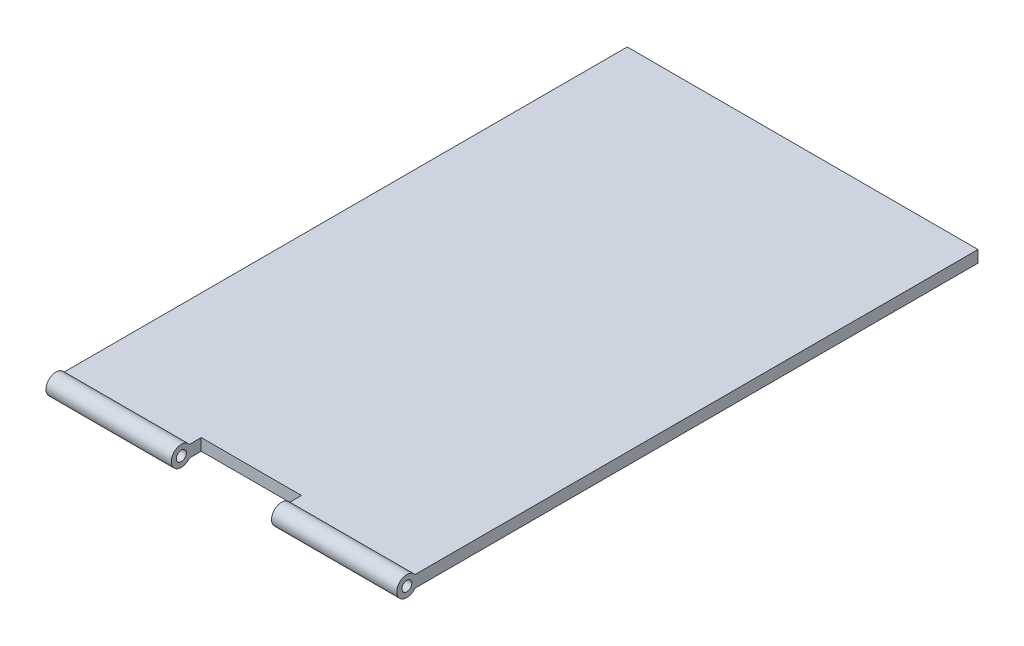
from build123d import *

# Parameters (mm, degrees)
SKETCH1_W               = 88.9
SKETCH1_H               = 139.7
BOSS_EXTRUDE1_DEPTH     = 3
SKETCH3_R               = 1.27
BOSS_EXTRUDE2_DEPTH     = 88.9
CUT_EXTRUDE1_DEPTH      = 90.381450537
CUT_EXTRUDE1_DEPTH_BACK = 90.381450537
SKETCH4_W               = 25.4
SKETCH4_H               = 17.737449085


with BuildPart() as part:
    # Sketch1 → Boss-Extrude1 (new body)
    with BuildSketch(Plane(origin=(0, 0, 0), x_dir=(1, 0, 0), z_dir=(0, 1, 0))):
        Rectangle(SKETCH1_W, SKETCH1_H)
    extrude(amount=BOSS_EXTRUDE1_DEPTH)

    # Sketch3 → Boss-Extrude2 (add)
    with BuildSketch(Plane(origin=(44.45, 0, 0), x_dir=(0, 0, -1), z_dir=(1, 0, 0))):
        with BuildLine():
            Line((-69.85, 0), (-69.85, 3))
            Line((-69.85, 3), (-72.85, 3))
            ThreePointArc((-72.85, 3), (-77.439780476, 1.5), (-72.85, 0))
            Line((-72.85, 0), (-69.85, 0))
        make_face()
        with Locations((-74.899780476, 1.5)):
            Circle(SKETCH3_R, mode=Mode.SUBTRACT)
    extrude(amount=-BOSS_EXTRUDE2_DEPTH)

    # Sketch4 → Cut-Extrude1 (cut, two sides: drawn at the far end of the back side and taken through both)
    with BuildSketch(Plane(origin=(0, 0, 0), x_dir=(1, 0, 0), z_dir=(0, 1, 0)).offset(-CUT_EXTRUDE1_DEPTH_BACK)):
        with Locations((0, -78.718724543)):
            Rectangle(SKETCH4_W, SKETCH4_H)
    extrude(amount=CUT_EXTRUDE1_DEPTH + CUT_EXTRUDE1_DEPTH_BACK, mode=Mode.SUBTRACT)


solid = part.part
